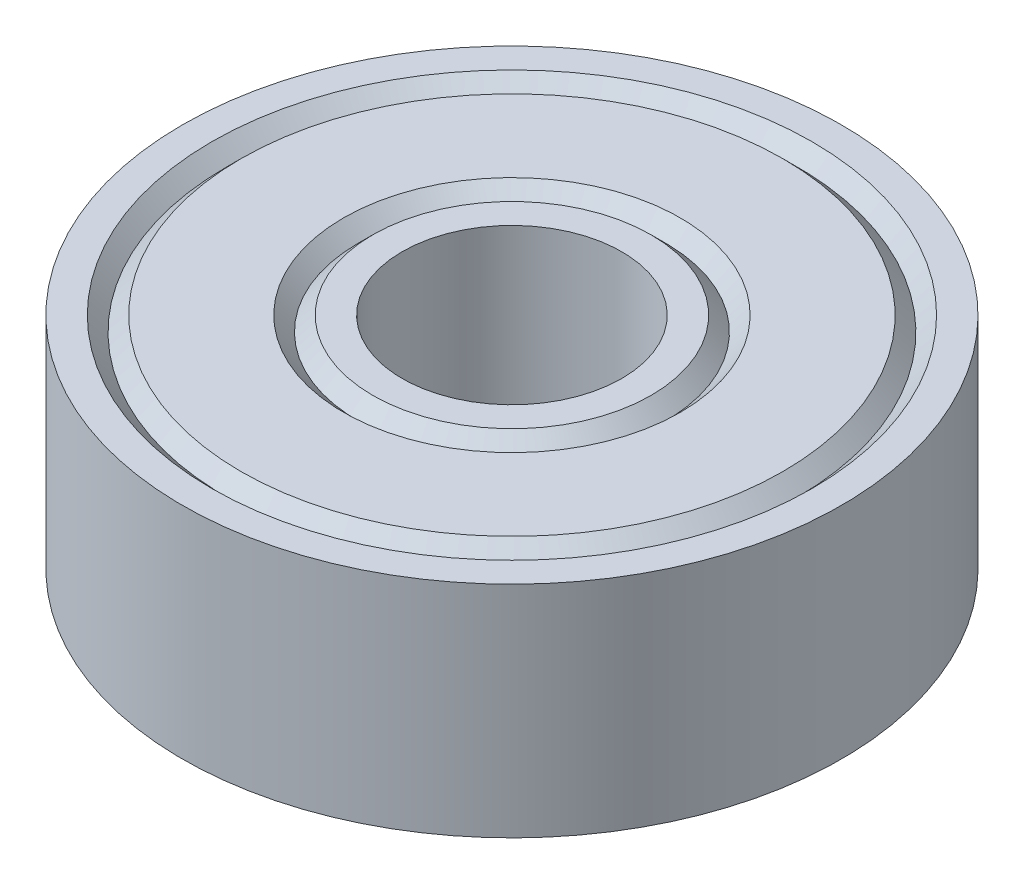
from build123d import *


with BuildPart() as part:
    # Sketch1 → Revolve1 (revolve)
    with BuildSketch(Plane.XY):
        Polygon((-4, 4), (-5.066666667, 4), (-5.6, 3.466666667), (-6.133333333, 4), (-9.866666667, 4), (-10.4, 3.466666667), (-10.933333333, 4), (-12, 4), (-12, -4), (-10.933333333, -4), (-10.4, -3.466666667), (-9.866666667, -4), (-6.133333333, -4), (-5.6, -3.466666667), (-5.066666667, -4), (-4, -4), align=None)
    revolve(axis=Axis((0, 4, 0), (0, -1, 0)))


solid = part.part
